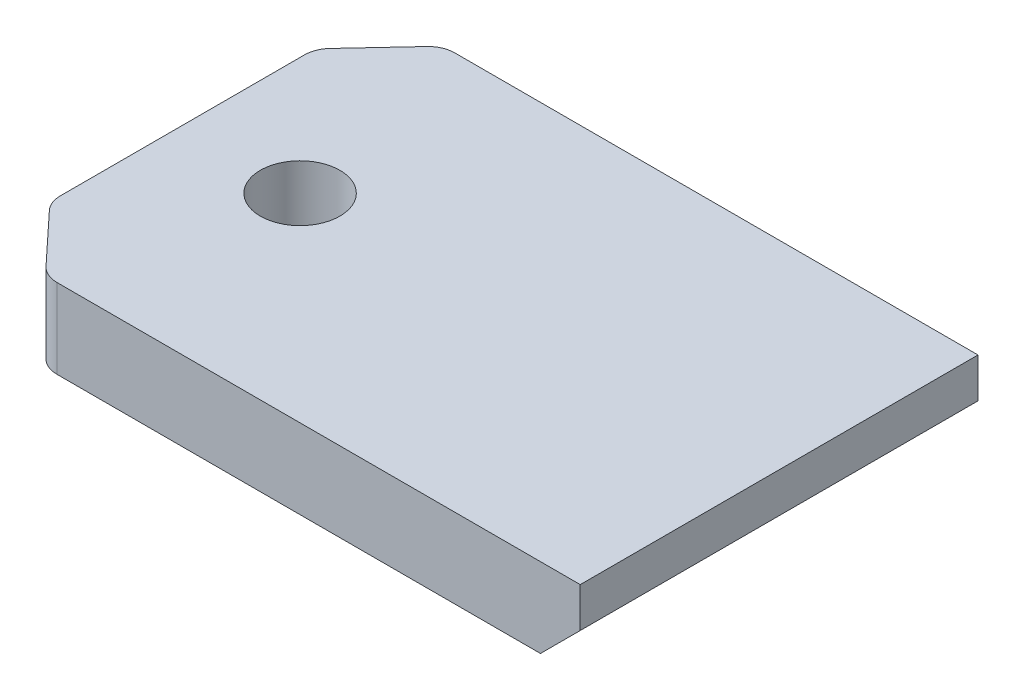
from build123d import *

# Parameters (mm, degrees)
SKETCH_1_W          = 30
SKETCH_1_H          = 6
EXTRUDE_1_DEPTH     = 45
CHAMFER_1_SIZE      = 3
SKETCH_2_R          = 3
CUT_EXTRUDE_1_DEPTH = 55.415071442
CHAMFER_2_SIZE      = 5
CHAMFER_2_SIZE2     = 4.662575431
FILLET_1_R          = 2


with BuildPart() as part:
    # Эскиз1 → Вытянуть1 (new body)
    with BuildSketch(Plane(origin=(0, 0, 0), x_dir=(0, 0, -1), z_dir=(1, 0, 0))):
        with Locations((15, -3)):
            Rectangle(SKETCH_1_W, SKETCH_1_H)
    extrude(amount=EXTRUDE_1_DEPTH)

    # Фаска1
    chamfer_1_edges = [part.edges().sort_by_distance(p)[0] for p in [
        (45, -6, -15),
    ]]
    chamfer(chamfer_1_edges, length=CHAMFER_1_SIZE)

    # Эскиз2 → Вырез-Вытянуть1 (cut, through all)
    with BuildSketch(Plane(origin=(0, 0, 0), x_dir=(-1, 0, 0), z_dir=(0, 1, 0))):
        with Locations(Location((-8.86993337, -14.999999492, 0), (0, 0, 90))):
            Circle(SKETCH_2_R)
    extrude(amount=-CUT_EXTRUDE_1_DEPTH, mode=Mode.SUBTRACT)

    # Фаска2
    chamfer_2_edges = [part.edges().sort_by_distance(p)[0] for p in [
        (0, -3, -30),
        (0, -3, 0),
    ]]
    chamfer_2_side = [part.faces().sort_by_distance(p)[0] for p in [
        (0, -3, -15),
    ]]
    chamfer(chamfer_2_edges, length=CHAMFER_2_SIZE, length2=CHAMFER_2_SIZE2, reference=chamfer_2_side[0])

    # Скругление1
    fillet_1_edges = [part.edges().sort_by_distance(p)[0] for p in [
        (4.662575431, -3, -30),
        (0, -3, -5),
        (0, -3, -25),
        (4.662575431, -3, 0),
    ]]
    fillet(fillet_1_edges, radius=FILLET_1_R)


solid = part.part
